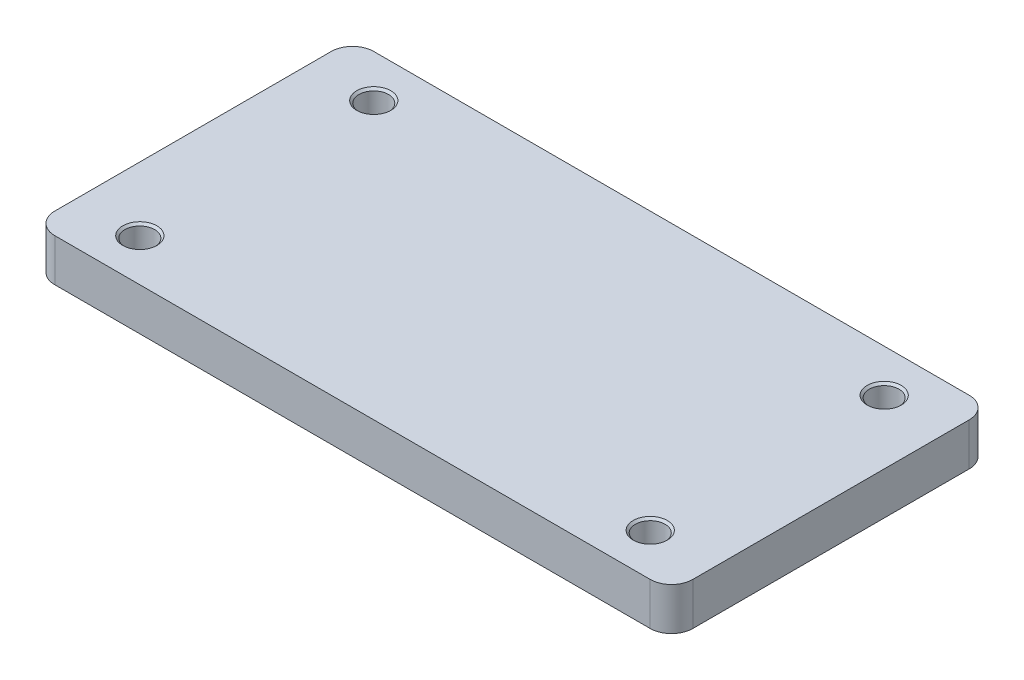
from build123d import *

# Parameters (mm, degrees)
SKETCH2_W                    = 300
SKETCH2_H                    = 150
BOSS_EXTRUDE1_DEPTH          = 10
FILLET1_R                    = 10
M16_TAPPED_HOLE1_D           = 14
M16_TAPPED_HOLE1_CSINK_D     = 16.05
M16_TAPPED_HOLE1_CSINK_ANGLE = 90


with BuildPart() as part:
    # Sketch2 → Boss-Extrude1 (new, symmetric)
    with BuildSketch(Plane(origin=(0, 0, 0), x_dir=(1, 0, 0), z_dir=(0, 1, 0))):
        Rectangle(SKETCH2_W, SKETCH2_H)
    extrude(amount=BOSS_EXTRUDE1_DEPTH, both=True)

    # Fillet1
    fillet1_edges = [part.edges().sort_by_distance(p)[0] for p in [
        (150, 0, 75),
        (-150, 0, 75),
        (-150, 0, -75),
        (150, 0, -75),
    ]]
    fillet(fillet1_edges, radius=FILLET1_R)

    # M16 Tapped Hole1 (through all)
    with Locations(Plane(origin=(-120, 10, -55), x_dir=(0, 0, 1), z_dir=(0, 1, 0))):
        with Locations((0, 0), (0, 240), (110, 240), (110, 0)):
            CounterSinkHole(M16_TAPPED_HOLE1_D / 2, M16_TAPPED_HOLE1_CSINK_D / 2, counter_sink_angle=M16_TAPPED_HOLE1_CSINK_ANGLE)


solid = part.part
